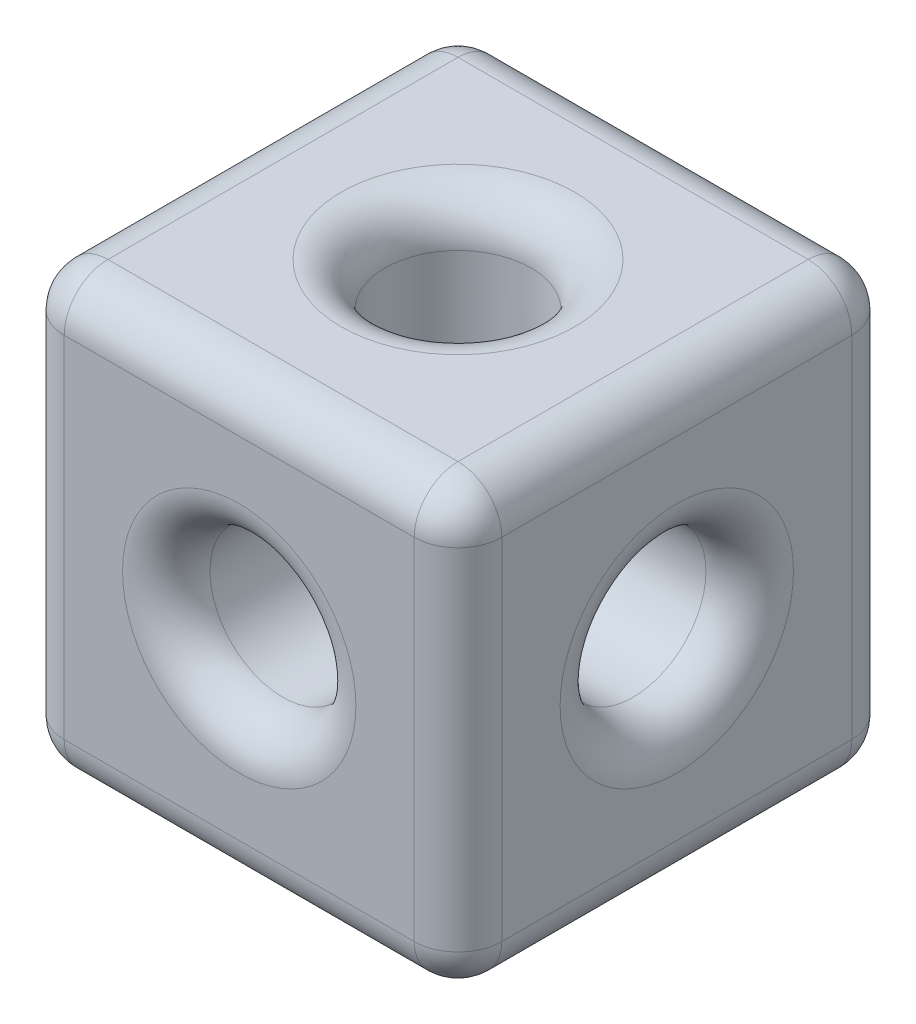
from build123d import *

# Parameters (mm, degrees)
EXTRUDE_1_DEPTH      = 3
EXTRUDE_1_DEPTH_BACK = 3
SKETCH_1_W           = 6
SKETCH_1_H           = 6
SKETCH_2_R           = 1
CUT_EXTRUDE_1_DEPTH  = 8.348469228
SKETCH_3_R           = 1
CUT_EXTRUDE_2_DEPTH  = 8.348469228
SKETCH_4_R           = 1
CUT_EXTRUDE_3_DEPTH  = 8.348469228
FILLET_1_R           = 0.6


with BuildPart() as part:
    # 草图1 → 凸台-拉伸1 (new, two sides: drawn at the far end of the back side and taken through both)
    with BuildSketch(Plane(origin=(0, 0, 0), x_dir=(1, 0, 0), z_dir=(0, 1, 0)).offset(-EXTRUDE_1_DEPTH_BACK)):
        Rectangle(SKETCH_1_W, SKETCH_1_H)
    extrude(amount=EXTRUDE_1_DEPTH + EXTRUDE_1_DEPTH_BACK)

    # 草图2 → 切除-拉伸1 (cut, through all)
    with BuildSketch(Plane.XY.offset(3)):
        Circle(SKETCH_2_R)
    extrude(amount=-CUT_EXTRUDE_1_DEPTH, mode=Mode.SUBTRACT)

    # 草图3 → 切除-拉伸2 (cut, through all)
    with BuildSketch(Plane(origin=(3, 0, 0), x_dir=(0, 0, -1), z_dir=(1, 0, 0))):
        Circle(SKETCH_3_R)
    extrude(amount=-CUT_EXTRUDE_2_DEPTH, mode=Mode.SUBTRACT)

    # 草图4 → 切除-拉伸3 (cut, through all)
    with BuildSketch(Plane(origin=(0, 3, 0), x_dir=(1, 0, 0), z_dir=(0, 1, 0))):
        Circle(SKETCH_4_R)
    extrude(amount=-CUT_EXTRUDE_3_DEPTH, mode=Mode.SUBTRACT)

    # 圆角1
    fillet_1_edges = [part.edges().sort_by_distance(p)[0] for p in [
        (3, -3, 0),
        (3, 0, 1),
        (0, -3, -3),
        (3, 0, -3),
        (-1, 0, -3),
        (-3, -3, 0),
        (-3, 0, -3),
        (-3, 0, 1),
        (0, -3, 3),
        (-3, 0, 3),
        (3, 0, 3),
        (-1, 0, 3),
        (0, 3, 3),
        (-3, 3, 0),
        (0, 3, -3),
        (3, 3, 0),
        (-1, 3, 0),
        (-1, -3, 0),
    ]]
    fillet(fillet_1_edges, radius=FILLET_1_R)


solid = part.part
